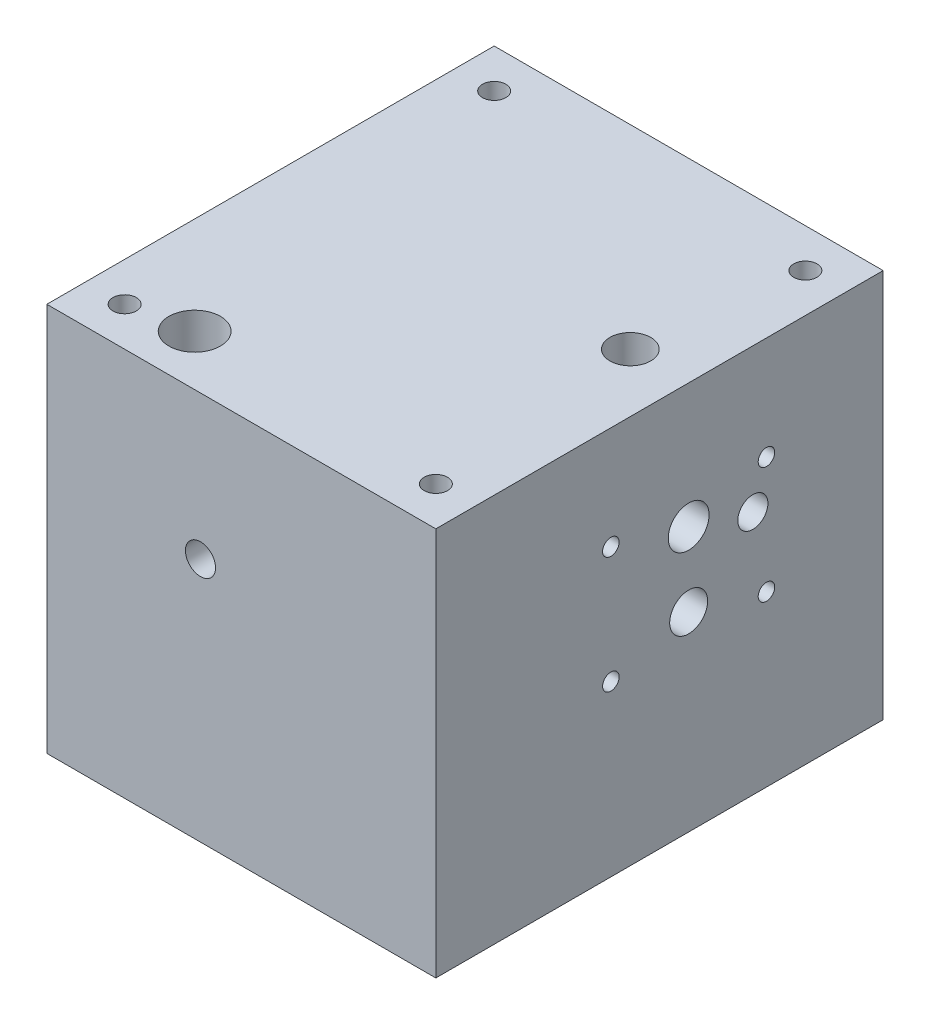
from build123d import *

# Parameters (mm, degrees)
SKETCH_1_W                     = 200
SKETCH_1_H                     = 200
EXTRUDE_1_DEPTH                = 200
HOLE_WIZARD_M10_1_D            = 8.5
HOLE_WIZARD_M10_1_DEPTH        = 17
HOLE_WIZARD_M10_1_TIP          = 2.553657631
HOLE_WIZARD_M8_1_D             = 6.8
HOLE_WIZARD_M8_1_DEPTH         = 25
HOLE_WIZARD_M8_1_TIP           = 2.042926105
HOLE_WIZARD_M14_2_D            = 12
HOLE_WIZARD_M14_2_DEPTH        = 17
HOLE_WIZARD_M14_2_TIP          = 3.605163714
HOLE_WIZARD_M24_1_D            = 21
HOLE_WIZARD_M24_1_DEPTH        = 60
HOLE_WIZARD_M24_1_TIP          = 6.3090365
HOLE_WIZARD_M24_2_D            = 21
HOLE_WIZARD_M24_2_DEPTH        = 42
HOLE_WIZARD_M24_2_TIP          = 6.3090365
HOLE_WIZARD_M22_1_D            = 19.5
HOLE_WIZARD_M22_1_DEPTH        = 111
HOLE_WIZARD_M22_1_TIP          = 5.858391036
HOLE_WIZARD_M22_3_D            = 19.5
HOLE_WIZARD_M22_3_DEPTH        = 90
HOLE_WIZARD_M22_3_TIP          = 5.858391036
HOLE_WIZARD_M22_4_D            = 19.5
HOLE_WIZARD_M22_4_DEPTH        = 75
HOLE_WIZARD_M22_4_TIP          = 5.858391036
HOLE_WIZARD_M18_1_D            = 15.5
HOLE_WIZARD_M18_1_DEPTH        = 88
HOLE_WIZARD_M18_1_TIP          = 4.656669797
HOLE_WIZARD_M18_4_D            = 15.5
HOLE_WIZARD_M18_4_DEPTH        = 130
HOLE_WIZARD_M18_4_TIP          = 4.656669797
HOLE_WIZARD_M22_5_D            = 19.5
HOLE_WIZARD_M22_5_DEPTH        = 79
HOLE_WIZARD_M22_5_TIP          = 5.858391036
HOLE_WIZARD_M10_2_D            = 8.5
HOLE_WIZARD_M10_2_DEPTH        = 10
HOLE_WIZARD_M10_2_TIP          = 2.553657631
HOLE_WIZARD_M10_1_2_D          = 8.5
HOLE_WIZARD_M10_1_2_DEPTH      = 40
HOLE_WIZARD_M10_1_2_TIP        = 2.553657631
HOLE_WIZARD_M10_2_2_AT_2_COUNT = 2
HOLE_WIZARD_M10_2_2_AT_2_PITCH = 25
HOLE_WIZARD_M24_3_D            = 21
HOLE_WIZARD_M24_3_DEPTH        = 40.5
HOLE_WIZARD_M24_3_TIP          = 6.3090365
HOLE_WIZARD_M24_4_D            = 21
HOLE_WIZARD_M24_4_DEPTH        = 62
HOLE_WIZARD_M24_4_TIP          = 6.3090365
HOLE_WIZARD_M18_5_D            = 15.5
HOLE_WIZARD_M18_5_DEPTH        = 133
HOLE_WIZARD_M18_5_TIP          = 4.656669797
HOLE_WIZARD_M18_7_D            = 15.5
HOLE_WIZARD_M18_7_DEPTH        = 107.7
HOLE_WIZARD_M18_7_TIP          = 4.656669797
HOLE_WIZARD_M18_8_REACH        = 199.596
HOLE_WIZARD_M18_8_BORE_R       = 7.75
HOLE_WIZARD_M22_6_D            = 19.5
HOLE_WIZARD_M22_6_DEPTH        = 39.75
HOLE_WIZARD_M22_6_TIP          = 5.858391036
SKETCH_110_W                   = 200
SKETCH_110_H                   = 200
EXTRUDE_2_DEPTH                = 30
HOLE_WIZARD_M14_2_2_D          = 12
HOLE_WIZARD_M18_9_D            = 15.5
HOLE_WIZARD_M18_9_DEPTH        = 62
HOLE_WIZARD_M18_9_TIP          = 4.656669797
HOLE_WIZARD_M30_1_D            = 26.5


with BuildPart() as part:
    # 草图1 → 凸台-拉伸1 (new body)
    with BuildSketch(Plane(origin=(0, 0, 0), x_dir=(1, 0, 0), z_dir=(0, 1, 0))):
        Rectangle(SKETCH_1_W, SKETCH_1_H)
    extrude(amount=EXTRUDE_1_DEPTH)

    # Hole Wizard M10 _1
    with Locations(Plane(origin=(100, 0, 0), x_dir=(0, 0, -1), z_dir=(1, 0, 0))):
        with Locations((-40, 87), (-40, 147), (40, 147), (40, 87)):
            Hole(HOLE_WIZARD_M10_1_D / 2, depth=HOLE_WIZARD_M10_1_DEPTH)
            with Locations((0, 0, -(HOLE_WIZARD_M10_1_DEPTH + HOLE_WIZARD_M10_1_TIP / 2))):  # 118° drill point
                Cone(0, HOLE_WIZARD_M10_1_D / 2, HOLE_WIZARD_M10_1_TIP, mode=Mode.SUBTRACT)

    # M8 螺纹孔1
    with Locations(Plane(origin=(0, 0, -100), x_dir=(-1, 0, 0), z_dir=(0, 0, -1))):
        with Locations((-44, 107), (-21, 53), (21, 53), (44, 107)):
            Hole(HOLE_WIZARD_M8_1_D / 2, depth=HOLE_WIZARD_M8_1_DEPTH)
            with Locations((0, 0, -(HOLE_WIZARD_M8_1_DEPTH + HOLE_WIZARD_M8_1_TIP / 2))):  # 118° drill point
                Cone(0, HOLE_WIZARD_M8_1_D / 2, HOLE_WIZARD_M8_1_TIP, mode=Mode.SUBTRACT)

    # Hole Wizard M14 _2
    with Locations(Plane.ZY.offset(100)):
        with Locations((23, 125.040370805), (-31, 125.040370805), (-31, 71.040370805), (23, 71.040370805)):
            Hole(HOLE_WIZARD_M14_2_D / 2, depth=HOLE_WIZARD_M14_2_DEPTH)
            with Locations((0, 0, -(HOLE_WIZARD_M14_2_DEPTH + HOLE_WIZARD_M14_2_TIP / 2))):  # 118° drill point
                Cone(0, HOLE_WIZARD_M14_2_D / 2, HOLE_WIZARD_M14_2_TIP, mode=Mode.SUBTRACT)

    # M24 螺纹孔的螺纹孔钻头1
    with Locations(Plane(origin=(0, 200, 0), x_dir=(1, 0, 0), z_dir=(0, 1, 0))):
        with Locations((70, 0)):
            Hole(HOLE_WIZARD_M24_1_D / 2, depth=HOLE_WIZARD_M24_1_DEPTH)
            with Locations((0, 0, -(HOLE_WIZARD_M24_1_DEPTH + HOLE_WIZARD_M24_1_TIP / 2))):  # 118° drill point
                Cone(0, HOLE_WIZARD_M24_1_D / 2, HOLE_WIZARD_M24_1_TIP, mode=Mode.SUBTRACT)

    # M24 螺纹孔的螺纹孔钻头2
    with Locations(Plane(origin=(100, 0, 0), x_dir=(0, 0, -1), z_dir=(1, 0, 0))):
        with Locations((0, 136)):
            Hole(HOLE_WIZARD_M24_2_D / 2, depth=HOLE_WIZARD_M24_2_DEPTH)
            with Locations((0, 0, -(HOLE_WIZARD_M24_2_DEPTH + HOLE_WIZARD_M24_2_TIP / 2))):  # 118° drill point
                Cone(0, HOLE_WIZARD_M24_2_D / 2, HOLE_WIZARD_M24_2_TIP, mode=Mode.SUBTRACT)

    # M22 螺纹孔的螺纹孔钻头1
    with Locations(Plane(origin=(0, 0, -100), x_dir=(-1, 0, 0), z_dir=(0, 0, -1))):
        with Locations((-21, 98)):
            Hole(HOLE_WIZARD_M22_1_D / 2, depth=HOLE_WIZARD_M22_1_DEPTH)
            with Locations((0, 0, -(HOLE_WIZARD_M22_1_DEPTH + HOLE_WIZARD_M22_1_TIP / 2))):  # 118° drill point
                Cone(0, HOLE_WIZARD_M22_1_D / 2, HOLE_WIZARD_M22_1_TIP, mode=Mode.SUBTRACT)

    # M22 螺纹孔的螺纹孔钻头3
    with Locations(Plane.ZY.offset(100)):
        with Locations((-25, 98)):
            Hole(HOLE_WIZARD_M22_3_D / 2, depth=HOLE_WIZARD_M22_3_DEPTH)
            with Locations((0, 0, -(HOLE_WIZARD_M22_3_DEPTH + HOLE_WIZARD_M22_3_TIP / 2))):  # 118° drill point
                Cone(0, HOLE_WIZARD_M22_3_D / 2, HOLE_WIZARD_M22_3_TIP, mode=Mode.SUBTRACT)

    # M22 螺纹孔的螺纹孔钻头4
    with Locations(Plane(origin=(0, 0, -100), x_dir=(-1, 0, 0), z_dir=(0, 0, -1))):
        with Locations((21, 98)):
            Hole(HOLE_WIZARD_M22_4_D / 2, depth=HOLE_WIZARD_M22_4_DEPTH)
            with Locations((0, 0, -(HOLE_WIZARD_M22_4_DEPTH + HOLE_WIZARD_M22_4_TIP / 2))):  # 118° drill point
                Cone(0, HOLE_WIZARD_M22_4_D / 2, HOLE_WIZARD_M22_4_TIP, mode=Mode.SUBTRACT)

    # M18 螺纹孔的螺纹孔钻头1
    with Locations(Plane.ZY.offset(100)):
        with Locations((0, 98.040370805)):
            Hole(HOLE_WIZARD_M18_1_D / 2, depth=HOLE_WIZARD_M18_1_DEPTH)
            with Locations((0, 0, -(HOLE_WIZARD_M18_1_DEPTH + HOLE_WIZARD_M18_1_TIP / 2))):  # 118° drill point
                Cone(0, HOLE_WIZARD_M18_1_D / 2, HOLE_WIZARD_M18_1_TIP, mode=Mode.SUBTRACT)

    # M18 螺纹孔的螺纹孔钻头4
    with Locations(Plane(origin=(100, 0, 0), x_dir=(0, 0, -1), z_dir=(1, 0, 0))):
        with Locations((33, 126)):
            Hole(HOLE_WIZARD_M18_4_D / 2, depth=HOLE_WIZARD_M18_4_DEPTH)
            with Locations((0, 0, -(HOLE_WIZARD_M18_4_DEPTH + HOLE_WIZARD_M18_4_TIP / 2))):  # 118° drill point
                Cone(0, HOLE_WIZARD_M18_4_D / 2, HOLE_WIZARD_M18_4_TIP, mode=Mode.SUBTRACT)

    # M22 螺纹孔的螺纹孔钻头5
    with Locations(Plane(origin=(100, 0, 0), x_dir=(0, 0, -1), z_dir=(1, 0, 0))):
        with Locations((0, 98)):
            Hole(HOLE_WIZARD_M22_5_D / 2, depth=HOLE_WIZARD_M22_5_DEPTH)
            with Locations((0, 0, -(HOLE_WIZARD_M22_5_DEPTH + HOLE_WIZARD_M22_5_TIP / 2))):  # 118° drill point
                Cone(0, HOLE_WIZARD_M22_5_D / 2, HOLE_WIZARD_M22_5_TIP, mode=Mode.SUBTRACT)

    # Hole Wizard M10 _2
    with Locations(Plane.ZY.offset(100)):
        with Locations((-9, 44), (-29, 44), (-29, 9), (-9, 9)):
            Hole(HOLE_WIZARD_M10_2_D / 2, depth=HOLE_WIZARD_M10_2_DEPTH)
            with Locations((0, 0, -(HOLE_WIZARD_M10_2_DEPTH + HOLE_WIZARD_M10_2_TIP / 2))):  # 118° drill point
                Cone(0, HOLE_WIZARD_M10_2_D / 2, HOLE_WIZARD_M10_2_TIP, mode=Mode.SUBTRACT)

    # Hole Wizard M10 _1 2
    with Locations(Plane.ZY.offset(100)):
        with Locations((0, 26.5), (-25, 26.5)):
            Hole(HOLE_WIZARD_M10_1_2_D / 2, depth=HOLE_WIZARD_M10_1_2_DEPTH)
            with Locations((0, 0, -(HOLE_WIZARD_M10_1_2_DEPTH + HOLE_WIZARD_M10_1_2_TIP / 2))):  # 118° drill point
                Cone(0, HOLE_WIZARD_M10_1_2_D / 2, HOLE_WIZARD_M10_1_2_TIP, mode=Mode.SUBTRACT)

    # 草图76 → Hole Wizard M10 _2 2 (revolve, cut)
    with BuildSketch(Plane(origin=(-64.25, 26.5, 0), x_dir=(0, 0, -1), z_dir=(1, 0, 0))):
        Polygon((0, 0), (0, 74.053657631), (4.25, 71.5), (4.25, 0), align=None)
    hole_wizard_m10_2_2 = revolve(axis=Axis((-64.25, 20.15, 0), (0, 1, 0)), mode=Mode.SUBTRACT)

    # Hole Wizard M10 _2 2 at 2: Hole Wizard M10 _2 2 ×2
    with Locations(*[(0, 0, -i * HOLE_WIZARD_M10_2_2_AT_2_PITCH) for i in range(1, HOLE_WIZARD_M10_2_2_AT_2_COUNT)]):
        add(hole_wizard_m10_2_2, mode=Mode.SUBTRACT)

    # M24 螺纹孔的螺纹孔钻头3
    with Locations(Plane(origin=(0, 0, -100), x_dir=(-1, 0, 0), z_dir=(0, 0, -1))):
        with Locations((0, 62)):
            Hole(HOLE_WIZARD_M24_3_D / 2, depth=HOLE_WIZARD_M24_3_DEPTH)
            with Locations((0, 0, -(HOLE_WIZARD_M24_3_DEPTH + HOLE_WIZARD_M24_3_TIP / 2))):  # 118° drill point
                Cone(0, HOLE_WIZARD_M24_3_D / 2, HOLE_WIZARD_M24_3_TIP, mode=Mode.SUBTRACT)

    # M24 螺纹孔的螺纹孔钻头4
    with Locations(Plane(origin=(0, 0, 0), x_dir=(-1, 0, 0), z_dir=(0, -1, 0))):
        with Locations((0, 70)):
            Hole(HOLE_WIZARD_M24_4_D / 2, depth=HOLE_WIZARD_M24_4_DEPTH)
            with Locations((0, 0, -(HOLE_WIZARD_M24_4_DEPTH + HOLE_WIZARD_M24_4_TIP / 2))):  # 118° drill point
                Cone(0, HOLE_WIZARD_M24_4_D / 2, HOLE_WIZARD_M24_4_TIP, mode=Mode.SUBTRACT)

    # M18 螺纹孔的螺纹孔钻头5
    with Locations(Plane.XY.offset(100)):
        with Locations((-21, 126)):
            Hole(HOLE_WIZARD_M18_5_D / 2, depth=HOLE_WIZARD_M18_5_DEPTH)
            with Locations((0, 0, -(HOLE_WIZARD_M18_5_DEPTH + HOLE_WIZARD_M18_5_TIP / 2))):  # 118° drill point
                Cone(0, HOLE_WIZARD_M18_5_D / 2, HOLE_WIZARD_M18_5_TIP, mode=Mode.SUBTRACT)

    # 草图90 → M18 螺纹孔的螺纹孔钻头6 (revolve, cut)
    with BuildSketch(Plane(origin=(-21, 100, 0), x_dir=(0, 0, -1), z_dir=(1, 0, 0))):
        Polygon((0, 0), (0, 32.656669797), (7.75, 28), (7.75, 0), align=None)
    revolve(axis=Axis((-21, 93.65, 0), (0, 1, 0)), mode=Mode.SUBTRACT)

    # M18 螺纹孔的螺纹孔钻头7
    with Locations(Plane(origin=(0, 0, -100), x_dir=(-1, 0, 0), z_dir=(0, 0, -1))):
        with Locations((42, 62)):
            Hole(HOLE_WIZARD_M18_7_D / 2, depth=HOLE_WIZARD_M18_7_DEPTH)
            with Locations((0, 0, -(HOLE_WIZARD_M18_7_DEPTH + HOLE_WIZARD_M18_7_TIP / 2))):  # 118° drill point
                Cone(0, HOLE_WIZARD_M18_7_D / 2, HOLE_WIZARD_M18_7_TIP, mode=Mode.SUBTRACT)

    # M18 螺纹孔的螺纹孔钻头8 bore → M18 螺纹孔的螺纹孔钻头8 (cut, up to next)
    with BuildSketch(Plane(origin=(0, 62, 0), x_dir=(-1, 0, 0), z_dir=(0, -1, 0)), mode=Mode.PRIVATE) as hole_wizard_m18_8_sk1:
        with Locations((42, 0)):
            Circle(HOLE_WIZARD_M18_8_BORE_R)
    hole_wizard_m18_8_tool1 = extrude(hole_wizard_m18_8_sk1.sketch, amount=-HOLE_WIZARD_M18_8_REACH, mode=Mode.PRIVATE) & part.part
    add(hole_wizard_m18_8_tool1.solids().sort_by_distance((-42, 62, 0))[0], mode=Mode.SUBTRACT)

    # M22 螺纹孔的螺纹孔钻头6
    with Locations(Plane(origin=(0, 0, -100), x_dir=(-1, 0, 0), z_dir=(0, 0, -1))):
        with Locations((-21, 160)):
            Hole(HOLE_WIZARD_M22_6_D / 2, depth=HOLE_WIZARD_M22_6_DEPTH)
            with Locations((0, 0, -(HOLE_WIZARD_M22_6_DEPTH + HOLE_WIZARD_M22_6_TIP / 2))):  # 118° drill point
                Cone(0, HOLE_WIZARD_M22_6_D / 2, HOLE_WIZARD_M22_6_TIP, mode=Mode.SUBTRACT)

    # 草图109 → M22 螺纹孔的螺纹孔钻头7 (revolve, cut)
    with BuildSketch(Plane(origin=(21, 160, -70), x_dir=(0, 0, 1), z_dir=(1, 0, 0))):
        Polygon((0, 0), (0, 67.858391036), (9.75, 62), (9.75, 0), align=None)
    revolve(axis=Axis((21, 166.35, -70), (0, -1, 0)), mode=Mode.SUBTRACT)

    # 草图110 → 凸台-拉伸2 (add)
    with BuildSketch(Plane.XY.offset(100)):
        with Locations((0, 100)):
            Rectangle(SKETCH_110_W, SKETCH_110_H)
    extrude(amount=EXTRUDE_2_DEPTH)

    # Hole Wizard M14 _2 2 (through all)
    with Locations(Plane(origin=(0, 0, 0), x_dir=(-1, 0, 0), z_dir=(0, -1, 0))):
        with Locations((-80, -110), (80, -110), (80, 80), (-80, 80)):
            Hole(HOLE_WIZARD_M14_2_2_D / 2)

    # M18 螺纹孔的螺纹孔钻头9
    with Locations(Plane.XY.offset(130)):
        with Locations((-21, 126)):
            Hole(HOLE_WIZARD_M18_9_D / 2, depth=HOLE_WIZARD_M18_9_DEPTH)
            with Locations((0, 0, -(HOLE_WIZARD_M18_9_DEPTH + HOLE_WIZARD_M18_9_TIP / 2))):  # 118° drill point
                Cone(0, HOLE_WIZARD_M18_9_D / 2, HOLE_WIZARD_M18_9_TIP, mode=Mode.SUBTRACT)

    # M30 螺纹孔的螺纹孔钻头1 (through all)
    with Locations(Plane(origin=(0, 0, 0), x_dir=(-1, 0, 0), z_dir=(0, -1, 0))):
        with Locations((50, -104)):
            Hole(HOLE_WIZARD_M30_1_D / 2)


solid = part.part
